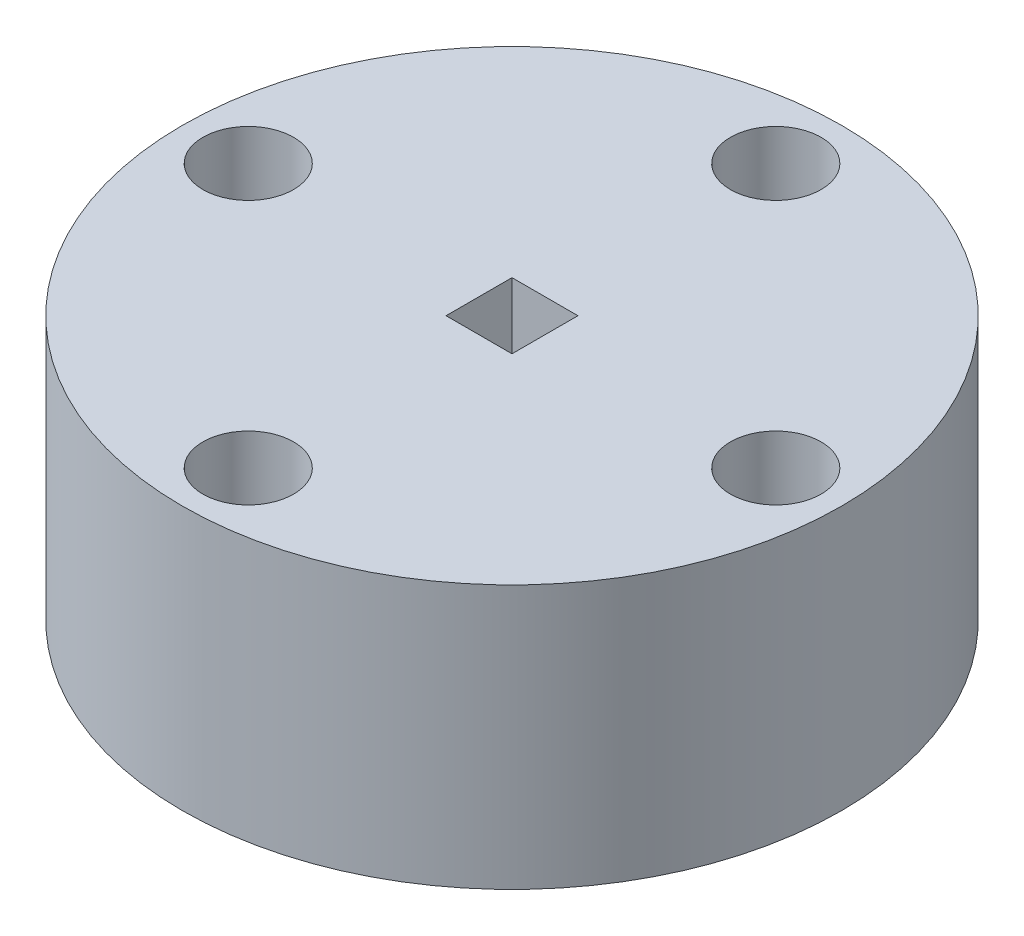
from build123d import *

# Parameters (mm, degrees)
SKETCH1_R           = 15.875
SKETCH1_R_2         = 2.1828125
SKETCH1_W           = 3.175
SKETCH1_H           = 3.175
BOSS_EXTRUDE1_DEPTH = 12.7


with BuildPart() as part:
    # Sketch1 → Boss-Extrude1 (new body)
    with BuildSketch(Plane(origin=(0, 0, 0), x_dir=(1, 0, 0), z_dir=(0, 1, 0))):
        with Locations(Location((0, 0, 0), (0, 0, 270))):
            Circle(SKETCH1_R)
        with Locations(Location((12.7, 0, 0), (0, 0, 270))):
            Circle(SKETCH1_R_2, mode=Mode.SUBTRACT)
        with Locations(Location((-12.7, 0, 0), (0, 0, 270))):
            Circle(SKETCH1_R_2, mode=Mode.SUBTRACT)
        with Locations(Location((0, 12.7, 0), (0, 0, 270))):
            Circle(SKETCH1_R_2, mode=Mode.SUBTRACT)
        with Locations(Location((0, -12.7, 0), (0, 0, 270))):
            Circle(SKETCH1_R_2, mode=Mode.SUBTRACT)
        Rectangle(SKETCH1_W, SKETCH1_H, mode=Mode.SUBTRACT)
    extrude(amount=BOSS_EXTRUDE1_DEPTH)


solid = part.part
